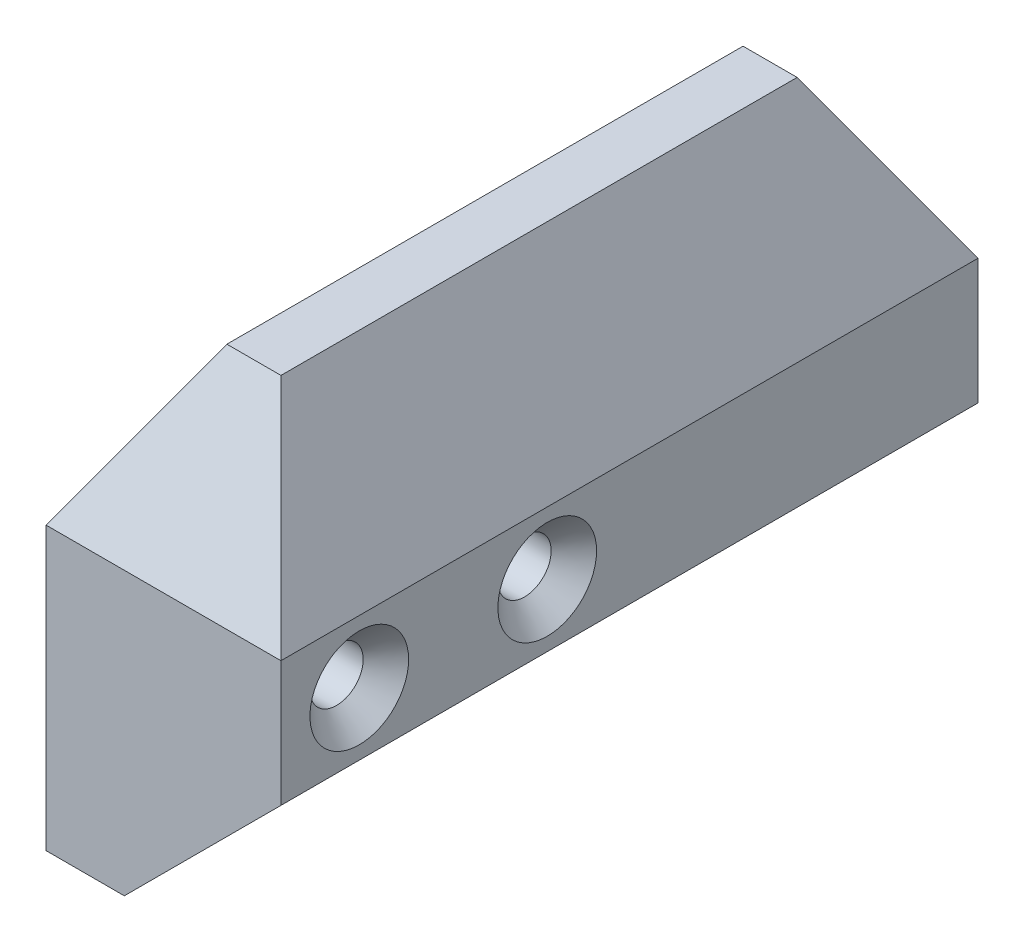
from build123d import *

# Parameters (mm, degrees)
BOSS_EXTRU_1_DEPTH                             = 44.5
ESQUISSE2_W                                    = 15
ESQUISSE2_H                                    = 11.547005384
ENL_V_MAT_EXTRU_1_DEPTH                        = 46.105349392
ESQUISSE4_W                                    = 15
ESQUISSE4_H                                    = 11.547005384
ENL_V_MAT_EXTRU_3_DEPTH                        = 53.740449787
BOSS_EXTRU_4_DEPTH                             = 44.5
FRAISAGE_POUR_VIS_T_TE_FRAIS_E_M31_D           = 3.4
FRAISAGE_POUR_VIS_T_TE_FRAIS_E_M31_CSINK_D     = 6.3
FRAISAGE_POUR_VIS_T_TE_FRAIS_E_M31_CSINK_ANGLE = 90
R_P_TITION_LIN_AIRE1_COUNT                     = 2
R_P_TITION_LIN_AIRE1_PITCH                     = 12


with BuildPart() as part:
    # Esquisse1 → Boss.-Extru.1 (new body)
    with BuildSketch(Plane.XY):
        Polygon((0, 8), (5.773502692, 18), (9.226497308, 18), (15, 8), (15, 0), (0, 0), align=None)
    extrude(amount=BOSS_EXTRU_1_DEPTH)

    # Esquisse2 → Enlèv. mat.-Extru.1 (cut, through all)
    with BuildSketch(Plane(origin=(0, 21.269065234, 36.839101615), x_dir=(-1, 0, 0), z_dir=(0, 0.500000000000001, 0.866025403784438))):
        with Locations((-7.5, 9.548294078)):
            Rectangle(ESQUISSE2_W, ESQUISSE2_H)
    extrude(amount=ENL_V_MAT_EXTRU_1_DEPTH, mode=Mode.SUBTRACT)

    # Esquisse4 → Enlèv. mat.-Extru.3 (cut, through all)
    with BuildSketch(Plane(origin=(0, 2, -3.464101615), x_dir=(-1, 0, 0), z_dir=(0, 0.500000000000001, -0.866025403784438))):
        with Locations((-7.5, 12.701705922)):
            Rectangle(ESQUISSE4_W, ESQUISSE4_H)
    extrude(amount=ENL_V_MAT_EXTRU_3_DEPTH, mode=Mode.SUBTRACT)

    # Esquisse5 → Boss.-Extru.4 (add)
    with BuildSketch(Plane.XY):
        Polygon((0, -10), (5, -10), (15, 0), (0, 0), align=None)
    extrude(amount=BOSS_EXTRU_4_DEPTH)

    # Fraisage pour vis à tête fraisée M31 (through all)
    with Locations(Plane(origin=(15, 0, 0), x_dir=(0, 0, -1), z_dir=(1, 0, 0))):
        with Locations((-39.5, 4)):
            fraisage_pour_vis_t_te_frais_e_m31 = CounterSinkHole(FRAISAGE_POUR_VIS_T_TE_FRAIS_E_M31_D / 2, FRAISAGE_POUR_VIS_T_TE_FRAIS_E_M31_CSINK_D / 2, counter_sink_angle=FRAISAGE_POUR_VIS_T_TE_FRAIS_E_M31_CSINK_ANGLE)

    # Répétition linéaire1: Fraisage pour vis à tête fraisée M31 ×2
    with Locations(*[(0, 0, -i * R_P_TITION_LIN_AIRE1_PITCH) for i in range(1, R_P_TITION_LIN_AIRE1_COUNT)]):
        add(fraisage_pour_vis_t_te_frais_e_m31, mode=Mode.SUBTRACT)


solid = part.part
